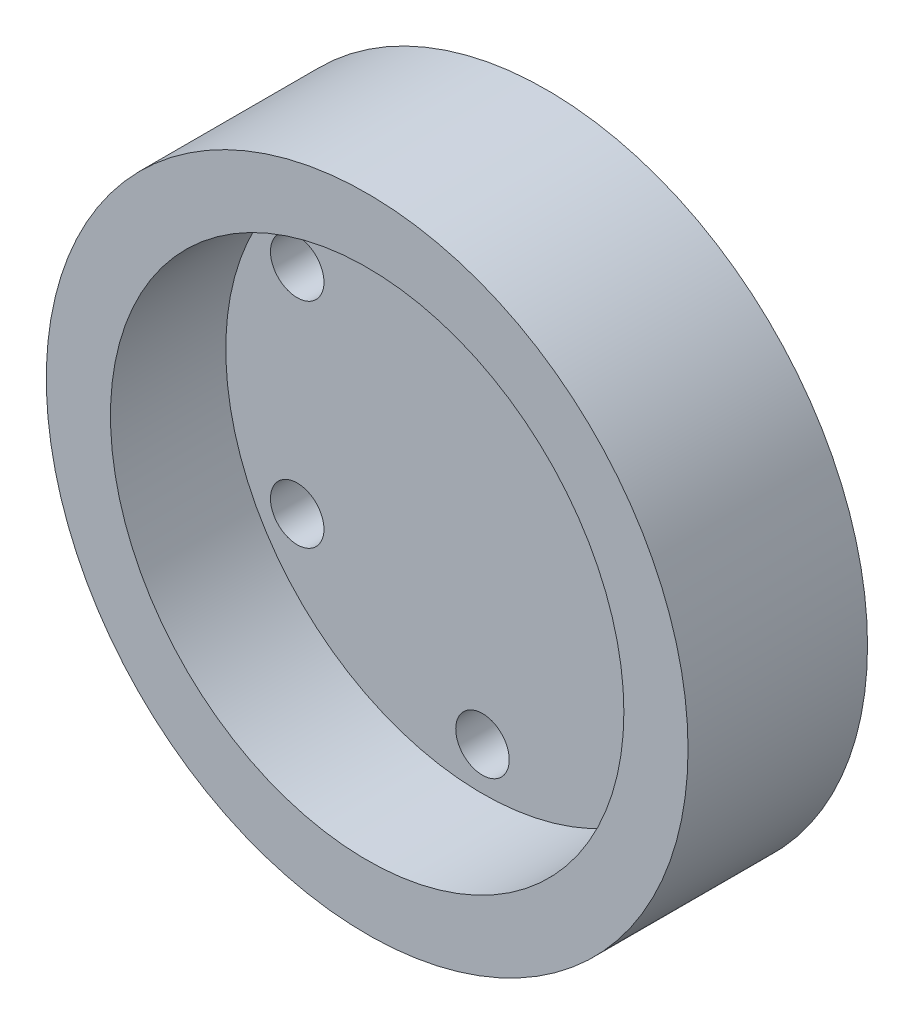
from build123d import *

# Parameters (mm, degrees)
SKETCH2_R           = 15
BOSS_EXTRUDE1_DEPTH = 8.39
SHELL1_T            = -3
SKETCH3_R           = 1.25
CUT_EXTRUDE1_DEPTH  = 5
SCALE1_SCALE        = 0.5


with BuildPart() as part:
    # Sketch2 → Boss-Extrude1 (new body)
    with BuildSketch(Plane.XY):
        Circle(SKETCH2_R)
    extrude(amount=BOSS_EXTRUDE1_DEPTH)

    # Shell1
    shell1_openings = [part.faces().sort_by_distance(p)[0] for p in [
        (0, 0, 8.39),
    ]]
    offset(amount=SHELL1_T, openings=shell1_openings, kind=Kind.INTERSECTION)

    # Sketch3 → Cut-Extrude1 (cut)
    with BuildSketch(Plane(origin=(0, 0, 0), x_dir=(-1, 0, 0), z_dir=(0, 0, -1))):
        with Locations((0, 10)):
            Circle(SKETCH3_R)
        with Locations((8.660254038, 5)):
            Circle(SKETCH3_R)
        with Locations((8.660254038, -5)):
            Circle(SKETCH3_R)
        with Locations((0, -10)):
            Circle(SKETCH3_R)
        with Locations((-8.660254038, -5)):
            Circle(SKETCH3_R)
        with Locations((-8.660254038, 5)):
            Circle(SKETCH3_R)
    extrude(amount=-CUT_EXTRUDE1_DEPTH, mode=Mode.SUBTRACT)


with BuildPart() as part_1:
    # Scale1: scaled about (0, 0, 3.190405366)
    add(part.part.scale(SCALE1_SCALE).moved(Location((0, 0, 1.595202683))))


solid = part_1.part
